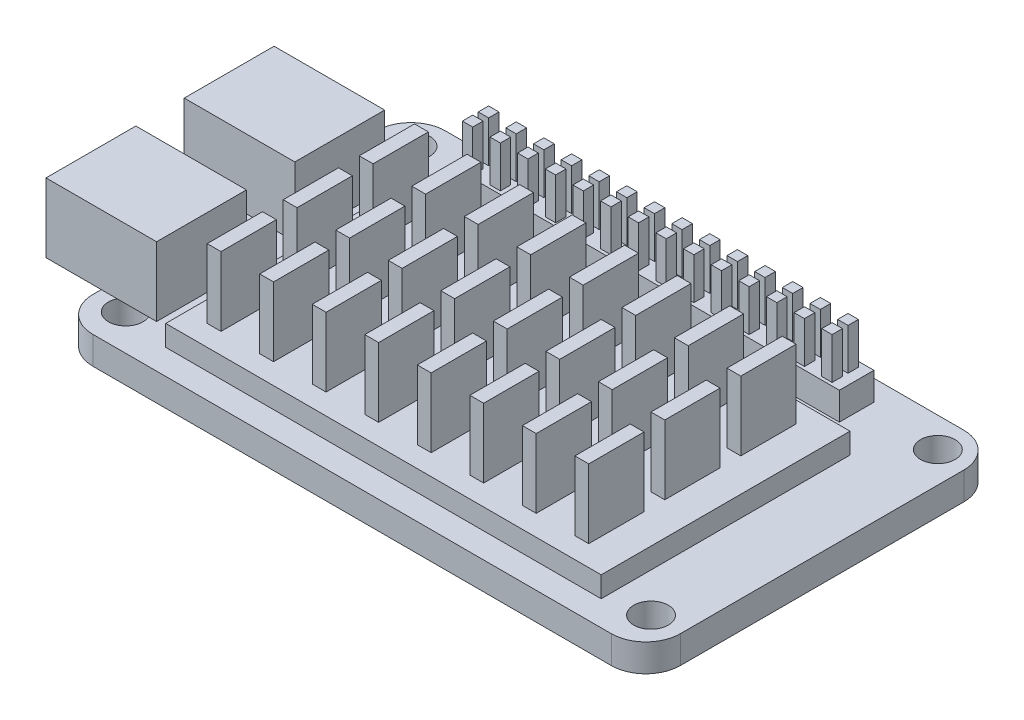
from build123d import *

# Parameters (mm, degrees)
BOSS_EXTRUDE1_DEPTH           = 4
SKETCH3_R                     = 2.5
CUT_EXTRUDE1_DEPTH            = 4
LPATTERN1_COUNT               = 2
LPATTERN1_PITCH               = 76
LPATTERN1_COUNT_DIR2          = 2
LPATTERN1_PITCH_DIR2          = 41.5
SKETCH4_W                     = 56
SKETCH4_H                     = 5
BOSS_EXTRUDE2_DEPTH           = 4
SKETCH5_W                     = 1.5
SKETCH5_H                     = 1.5
BOSS_EXTRUDE3_DEPTH           = 6
LPATTERN2_COUNT               = 14
LPATTERN2_PITCH               = 4
LPATTERN2_COUNT_DIR2          = 2
LPATTERN2_PITCH_DIR2          = 2.3
SKETCH6_W                     = 13
SKETCH6_H                     = 10
USB_HUB_DEPTH                 = 8
SKETCH7_W                     = 12
SKETCH7_H                     = 4.5
USB_DEPTH                     = 12
USB_HUB_PATTERN_COUNT         = 2
USB_HUB_PATTERN_PITCH         = 20
SKETCH8_W                     = 63
SKETCH8_H                     = 36
HEAT_SINK_BODY_DEPTH          = 3
SKETCH9_W                     = 2
SKETCH9_H                     = 8
HEAT_SINK_STICKS_DEPTH        = 10
HEAT_SINK_STICK_PATTERN_COUNT = 8
HEAT_SINK_STICK_PATTERN_PITCH = 7.6


with BuildPart() as part:
    # Sketch1 → Boss-Extrude1 (new body)
    with BuildSketch(Plane(origin=(0, 0, 0), x_dir=(1, 0, 0), z_dir=(0, 1, 0))):
        with BuildLine():
            Line((5, 0), (80, 0))
            ThreePointArc((80, 0), (83.535533906, -1.464466094), (85, -5))
            Line((85, -5), (85, -46))
            ThreePointArc((85, -46), (83.535533906, -49.535533906), (80, -51))
            Line((80, -51), (5, -51))
            ThreePointArc((5, -51), (1.464466094, -49.535533906), (0, -46))
            Line((0, -46), (0, -5))
            ThreePointArc((0, -5), (1.464466094, -1.464466094), (5, 0))
        make_face()
    extrude(amount=BOSS_EXTRUDE1_DEPTH)

    # Sketch3 → Cut-Extrude1 (cut)
    with BuildSketch(Plane(origin=(0, 4, 0), x_dir=(1, 0, 0), z_dir=(0, 1, 0))):
        with Locations(Location((4.556037157, -4.305653307, 0), (0, 0, 270))):
            Circle(SKETCH3_R)
    cut_extrude1 = extrude(amount=-CUT_EXTRUDE1_DEPTH, mode=Mode.SUBTRACT)

    # LPattern1: Cut-Extrude1 2 × 2
    with Locations(*[(i * LPATTERN1_PITCH, 0, j * LPATTERN1_PITCH_DIR2) for i in range(LPATTERN1_COUNT) for j in range(LPATTERN1_COUNT_DIR2) if (i, j) != (0, 0)]):
        add(cut_extrude1, mode=Mode.SUBTRACT)

    # Sketch4 → Boss-Extrude2 (add)
    with BuildSketch(Plane(origin=(0, 4, 0), x_dir=(1, 0, 0), z_dir=(0, 1, 0))):
        with Locations((42, -5.5)):
            Rectangle(SKETCH4_W, SKETCH4_H)
    extrude(amount=BOSS_EXTRUDE2_DEPTH)

    # Sketch5 → Boss-Extrude3 (add)
    with BuildSketch(Plane(origin=(0, 8, 0), x_dir=(1, 0, 0), z_dir=(0, 1, 0))):
        with Locations((15.75, -4.5)):
            Rectangle(SKETCH5_W, SKETCH5_H)
    boss_extrude3 = extrude(amount=BOSS_EXTRUDE3_DEPTH)

    # LPattern2: Boss-Extrude3 14 × 2
    with Locations(*[(i * LPATTERN2_PITCH, 0, j * LPATTERN2_PITCH_DIR2) for i in range(LPATTERN2_COUNT) for j in range(LPATTERN2_COUNT_DIR2) if (i, j) != (0, 0)]):
        add(boss_extrude3)

    # Sketch6 → usb hub (add, symmetric)
    with BuildSketch(Plane(origin=(0, 0, 0), x_dir=(0, 0, -1), z_dir=(1, 0, 0))):
        with Locations((-38.285451891, 9)):
            Rectangle(SKETCH6_W, SKETCH6_H)
    usb_hub = extrude(amount=USB_HUB_DEPTH, both=True)

    # Sketch7 → usb (cut)
    with BuildSketch(Plane.ZY.offset(8)):
        with Locations((38.285451891, 11.3185343)):
            Rectangle(SKETCH7_W, SKETCH7_H)
        with Locations((38.285451891, 6.5185343)):
            Rectangle(SKETCH7_W, SKETCH7_H)
    usb = extrude(amount=-USB_DEPTH, mode=Mode.SUBTRACT)

    # usb hub pattern: usb hub, usb ×2
    with Locations(*[(0, 0, -i * USB_HUB_PATTERN_PITCH) for i in range(1, USB_HUB_PATTERN_COUNT)]):
        add(usb_hub)
        add(usb, mode=Mode.SUBTRACT)

    # Sketch8 → Heat Sink Body (add)
    with BuildSketch(Plane(origin=(0, 4, 0), x_dir=(1, 0, 0), z_dir=(0, 1, 0))):
        with Locations((43.396150795, -29.358166511)):
            Rectangle(SKETCH8_W, SKETCH8_H)
    extrude(amount=HEAT_SINK_BODY_DEPTH)

    # Sketch9 → Heat Sink Sticks (add)
    with BuildSketch(Plane(origin=(0, 7, 0), x_dir=(1, 0, 0), z_dir=(0, 1, 0))):
        with Locations((15.896150795, -18.358166511)):
            Rectangle(SKETCH9_W, SKETCH9_H)
        with Locations((15.896150795, -29.358166511)):
            Rectangle(SKETCH9_W, SKETCH9_H)
        with Locations((15.896150795, -40.358166511)):
            Rectangle(SKETCH9_W, SKETCH9_H)
    heat_sink_sticks = extrude(amount=HEAT_SINK_STICKS_DEPTH)

    # heat sink stick pattern: Heat Sink Sticks ×8
    with Locations(*[(i * HEAT_SINK_STICK_PATTERN_PITCH, 0, 0) for i in range(1, HEAT_SINK_STICK_PATTERN_COUNT)]):
        add(heat_sink_sticks)


solid = part.part
